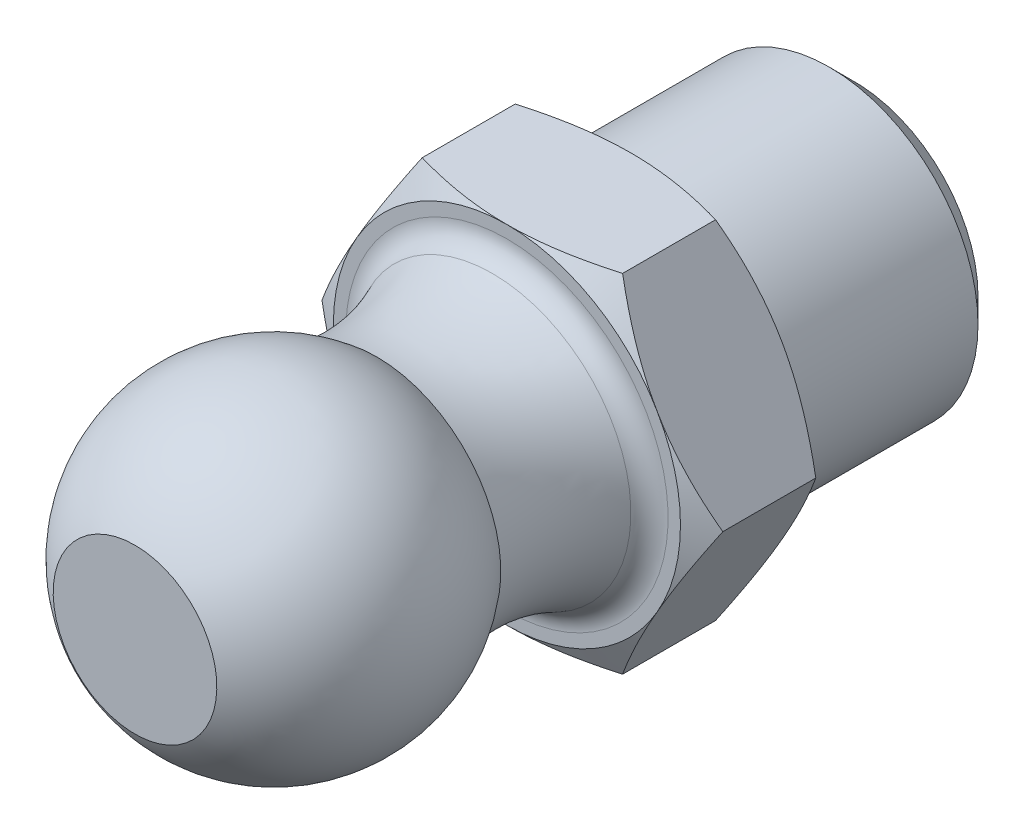
from build123d import *

# Parameters (mm, degrees)
VYSUNOUT1_DEPTH = 1.25
SKICA4_R        = 3
VYSUNOUT2_DEPTH = 4.5
ZKOSIT1_SIZE    = 0.5


with BuildPart() as part:
    # Skica1 → Vysunout1 (new, symmetric)
    with BuildSketch(Plane.XY):
        Polygon((4.041451884, 0), (2.020725942, 3.5), (-2.020725942, 3.5), (-4.041451884, 0), (-2.020725942, -3.5), (2.020725942, -3.5), align=None)
    extrude(amount=VYSUNOUT1_DEPTH, both=True)

    # Skica2 → Odebrat otočením1 (revolve, cut)
    with BuildSketch(Plane(origin=(0, 0, 0), x_dir=(0, 0, -1), z_dir=(1, 0, 0))):
        Polygon((-1.25, 3.5), (-1.25, 5.142284655), (-0.301826512, 5.142284655), align=None)
    odebrat_oto_en_m1 = revolve(axis=Axis((0, 0, 1.25), (0, 0, 1)), mode=Mode.SUBTRACT)

    # Zrcadlit1: Odebrat otočením1 across plane
    add(odebrat_oto_en_m1.mirror(Plane.XY), mode=Mode.SUBTRACT)

    # Skica3 → Otočit kolem osy1 (revolve)
    with BuildSketch(Plane(origin=(0, 0, 0), x_dir=(0, 0, -1), z_dir=(1, 0, 0)), mode=Mode.PRIVATE) as oto_it_kolem_osy1_sk:
        with BuildLine():
            Line((-8.75, 1.65), (-8.75, 0))
            Line((-8.75, 0), (-1.25, 0))
            Line((-1.25, 0), (-1.25, 3.25))
            ThreePointArc((-1.25, 3.25), (-1.33004432, 2.978638199), (-1.544548907, 2.794160282))
            ThreePointArc((-1.544548907, 2.794160282), (-2.686883352, 2.472411814), (-3.873344034, 2.5))
            ThreePointArc((-3.873344034, 2.5), (-6.508060613, 3.201728963), (-8.75, 1.65))
        make_face()
    revolve(oto_it_kolem_osy1_sk.sketch.rotate(Axis((0, 0, 1.25), (0, 0, -1)), 180), axis=Axis((0, 0, 1.25), (0, 0, -1)))

    # Skica4 → Vysunout2 (add)
    with BuildSketch(Plane(origin=(0, 0, -1.25), x_dir=(-1, 0, 0), z_dir=(0, 0, -1))):
        Circle(SKICA4_R)
    extrude(amount=VYSUNOUT2_DEPTH)

    # Zkosit1
    zkosit1_edges = [part.edges().sort_by_distance(p)[0] for p in [
        (3, 0, -5.75),
    ]]
    chamfer(zkosit1_edges, length=ZKOSIT1_SIZE)


solid = part.part
